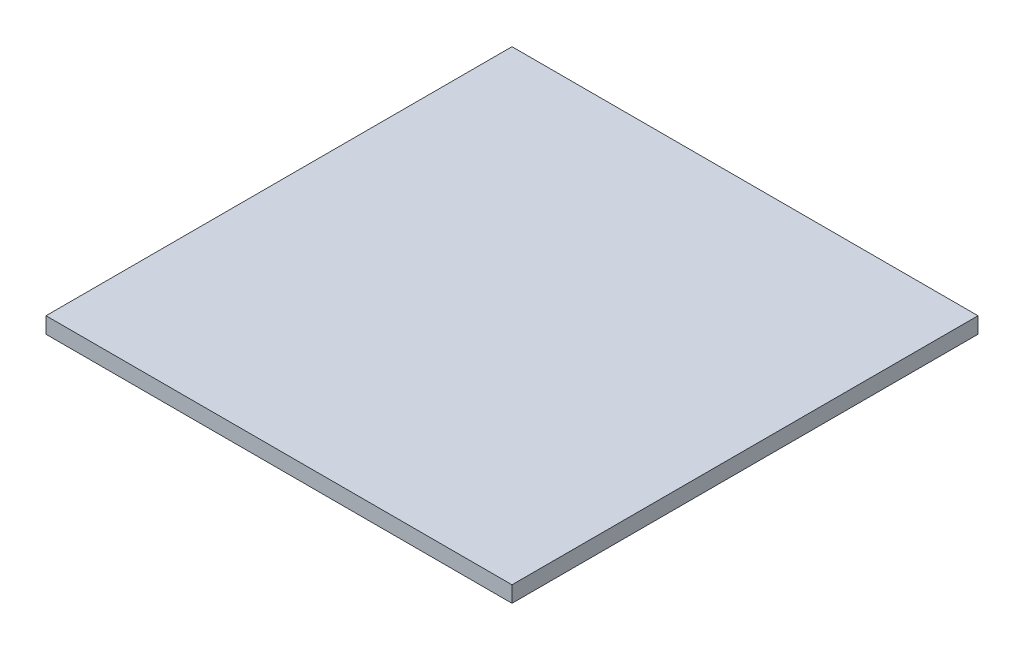
from build123d import *

# Parameters (mm, degrees)
SKETCH1_W           = 86.997169163
SKETCH1_H           = 86.997169162
BOSS_EXTRUDE1_DEPTH = 3


with BuildPart() as part:
    # Sketch1 → Boss-Extrude1 (new body)
    with BuildSketch(Plane(origin=(0, 23, 0), x_dir=(1, 0, 0), z_dir=(0, 1, 0))):
        with Locations((140.917960408, 0)):
            Rectangle(SKETCH1_W, SKETCH1_H)
    extrude(amount=BOSS_EXTRUDE1_DEPTH)


solid = part.part
